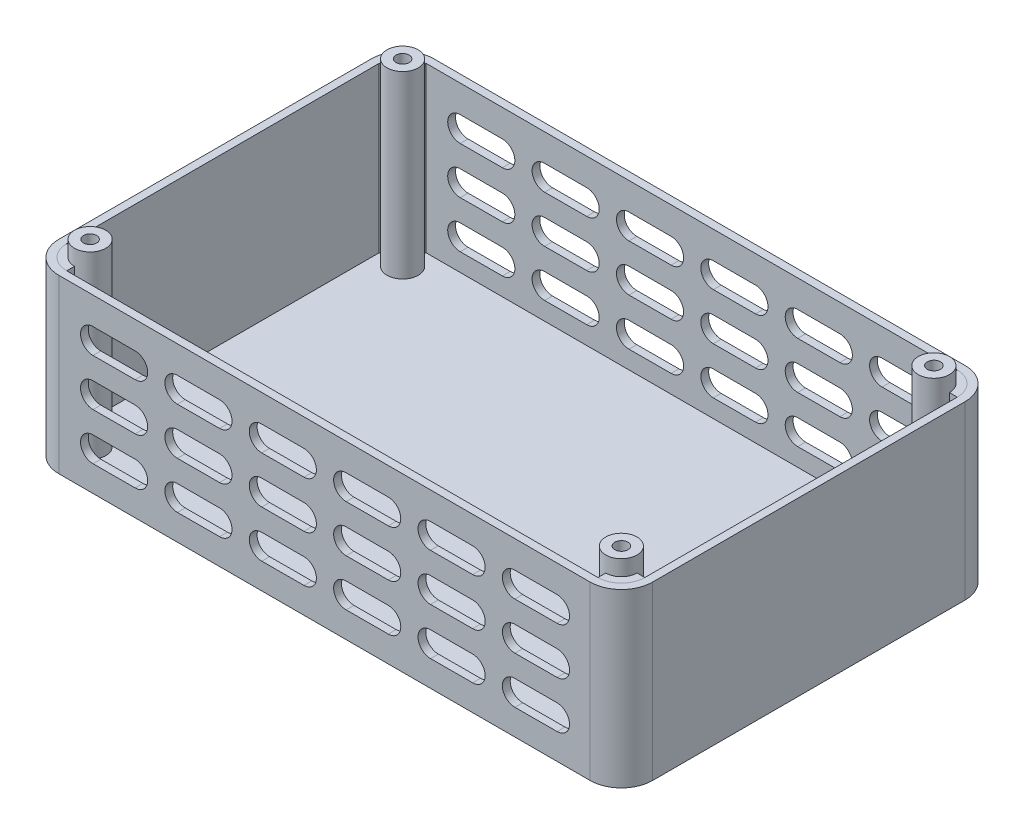
from build123d import *

# Parameters (mm, degrees)
SKETCH25_W                       = 190
SKETCH25_H                       = 120
BOSS_EXTRUDE5_DEPTH              = 55
FILLET2_R                        = 10
SHELL4_T                         = -2.5
SKETCH26_R                       = 5
BOSS_EXTRUDE8_DEPTH              = 57.5
BOSS_EXTRUDE9_DEPTH              = 52.5
BOSS_EXTRUDE9_2_DEPTH            = 52.5
BOSS_EXTRUDE9_3_DEPTH            = 52.5
BOSS_EXTRUDE9_4_DEPTH            = 52.5
CUT_EXTRUDE3_DEPTH               = 3
CUT_EXTRUDE4_START               = -3
CUT_EXTRUDE4_DEPTH               = 3
TAP_DRILL_FOR_M5_TAP1_AT_2_COUNT = 2
TAP_DRILL_FOR_M5_TAP1_AT_2_PITCH = 100
TAP_DRILL_FOR_M5_TAP1_AT_3_COUNT = 2
TAP_DRILL_FOR_M5_TAP1_AT_3_PITCH = 170
TAP_DRILL_FOR_M5_TAP1_AT_4_COUNT = 2
TAP_DRILL_FOR_M5_TAP1_AT_4_PITCH = 197.230829233


with BuildPart() as part:
    # Sketch25 → Boss-Extrude5 (new body)
    with BuildSketch(Plane(origin=(0, 0, 0), x_dir=(1, 0, 0), z_dir=(0, 1, 0))):
        with Locations((-0.175936119, -144.891398577)):
            Rectangle(SKETCH25_W, SKETCH25_H)
    extrude(amount=BOSS_EXTRUDE5_DEPTH)

    # Fillet2
    fillet2_edges = [part.edges().sort_by_distance(p)[0] for p in [
        (-95.175936119, 27.5, 84.891398577),
        (94.824063881, 27.5, 84.891398577),
        (94.824063881, 27.5, 204.891398577),
        (-95.175936119, 27.5, 204.891398577),
    ]]
    fillet(fillet2_edges, radius=FILLET2_R)

    # Shell4
    shell4_openings = [part.faces().sort_by_distance(p)[0] for p in [
        (-0.175936119, 55, 144.891398577),
    ]]
    offset(amount=SHELL4_T, openings=shell4_openings, kind=Kind.INTERSECTION)

    # Sketch26 → Boss-Extrude8 (add)
    with BuildSketch(Plane(origin=(0, 2.5, 0), x_dir=(1, 0, 0), z_dir=(0, 1, 0))):
        with Locations(Location((-85.175936119, -94.891398577, 0), (0, 0, 270))):
            Circle(SKETCH26_R)
        with Locations(Location((84.824063881, -94.891398577, 0), (0, 0, 270))):
            Circle(SKETCH26_R)
        with Locations(Location((-85.175936119, -194.891398577, 0), (0, 0, 270))):
            Circle(SKETCH26_R)
        with Locations(Location((84.824063881, -194.891398577, 0), (0, 0, 270))):
            Circle(SKETCH26_R)
    extrude(amount=BOSS_EXTRUDE8_DEPTH)

    # Sketch32 → Cut-Extrude3 (cut)
    with BuildSketch(Plane.XY.offset(204.891398577)):
        with BuildLine():
            Line((-74.249946348, 38.253764584), (-60.75, 38.291825034))
            ThreePointArc((-60.75, 38.291825034), (-56.769030225, 42.272794809), (-60.75, 46.253764584))
            Line((-60.75, 46.253764584), (-74.25, 46.253764584))
            ThreePointArc((-74.25, 46.253764584), (-78.25, 42.253737758), (-74.249946348, 38.253764584))
        make_face()
        with BuildLine():
            Line((-33.75, 46.253764584), (-47.25, 46.253764584))
            ThreePointArc((-47.25, 46.253764584), (-51.25, 42.253737758), (-47.249946348, 38.253764584))
            Line((-47.249946348, 38.253764584), (-33.75, 38.291825034))
            ThreePointArc((-33.75, 38.291825034), (-29.769030225, 42.272794809), (-33.75, 46.253764584))
        make_face()
        with BuildLine():
            Line((-6.75, 46.253764584), (-20.25, 46.253764584))
            ThreePointArc((-20.25, 46.253764584), (-24.25, 42.253737758), (-20.249946348, 38.253764584))
            Line((-20.249946348, 38.253764584), (-6.75, 38.291825034))
            ThreePointArc((-6.75, 38.291825034), (-2.769030225, 42.272794809), (-6.75, 46.253764584))
        make_face()
        with BuildLine():
            Line((20.25, 46.253764584), (6.75, 46.253764584))
            ThreePointArc((6.75, 46.253764584), (2.75, 42.253737758), (6.750053652, 38.253764584))
            Line((6.750053652, 38.253764584), (20.25, 38.291825034))
            ThreePointArc((20.25, 38.291825034), (24.230969775, 42.272794809), (20.25, 46.253764584))
        make_face()
        with BuildLine():
            Line((47.25, 46.253764584), (33.75, 46.253764584))
            ThreePointArc((33.75, 46.253764584), (29.75, 42.253737758), (33.750053652, 38.253764584))
            Line((33.750053652, 38.253764584), (47.25, 38.291825034))
            ThreePointArc((47.25, 38.291825034), (51.230969775, 42.272794809), (47.25, 46.253764584))
        make_face()
        with BuildLine():
            Line((74.25, 46.253764584), (60.75, 46.253764584))
            ThreePointArc((60.75, 46.253764584), (56.75, 42.253737758), (60.750053652, 38.253764584))
            Line((60.750053652, 38.253764584), (74.25, 38.291825034))
            ThreePointArc((74.25, 38.291825034), (78.230969775, 42.272794809), (74.25, 46.253764584))
        make_face()
        with BuildLine():
            Line((-33.75, 31.253764584), (-47.25, 31.253764584))
            ThreePointArc((-47.25, 31.253764584), (-51.25, 27.253737758), (-47.249946348, 23.253764584))
            Line((-47.249946348, 23.253764584), (-33.75, 23.291825034))
            ThreePointArc((-33.75, 23.291825034), (-29.769030225, 27.272794809), (-33.75, 31.253764584))
        make_face()
        with BuildLine():
            Line((-6.75, 31.253764584), (-20.25, 31.253764584))
            ThreePointArc((-20.25, 31.253764584), (-24.25, 27.253737758), (-20.249946348, 23.253764584))
            Line((-20.249946348, 23.253764584), (-6.75, 23.291825034))
            ThreePointArc((-6.75, 23.291825034), (-2.769030225, 27.272794809), (-6.75, 31.253764584))
        make_face()
        with BuildLine():
            Line((20.25, 31.253764584), (6.75, 31.253764584))
            ThreePointArc((6.75, 31.253764584), (2.75, 27.253737758), (6.750053652, 23.253764584))
            Line((6.750053652, 23.253764584), (20.25, 23.291825034))
            ThreePointArc((20.25, 23.291825034), (24.230969775, 27.272794809), (20.25, 31.253764584))
        make_face()
        with BuildLine():
            Line((47.25, 31.253764584), (33.75, 31.253764584))
            ThreePointArc((33.75, 31.253764584), (29.75, 27.253737758), (33.750053652, 23.253764584))
            Line((33.750053652, 23.253764584), (47.25, 23.291825034))
            ThreePointArc((47.25, 23.291825034), (51.230969775, 27.272794809), (47.25, 31.253764584))
        make_face()
        with BuildLine():
            Line((74.25, 31.253764584), (60.75, 31.253764584))
            ThreePointArc((60.75, 31.253764584), (56.75, 27.253737758), (60.750053652, 23.253764584))
            Line((60.750053652, 23.253764584), (74.25, 23.291825034))
            ThreePointArc((74.25, 23.291825034), (78.230969775, 27.272794809), (74.25, 31.253764584))
        make_face()
        with BuildLine():
            Line((-33.75, 16.253764584), (-47.25, 16.253764584))
            ThreePointArc((-47.25, 16.253764584), (-51.25, 12.253737758), (-47.249946348, 8.253764584))
            Line((-47.249946348, 8.253764584), (-33.75, 8.291825034))
            ThreePointArc((-33.75, 8.291825034), (-29.769030225, 12.272794809), (-33.75, 16.253764584))
        make_face()
        with BuildLine():
            Line((-6.75, 16.253764584), (-20.25, 16.253764584))
            ThreePointArc((-20.25, 16.253764584), (-24.25, 12.253737758), (-20.249946348, 8.253764584))
            Line((-20.249946348, 8.253764584), (-6.75, 8.291825034))
            ThreePointArc((-6.75, 8.291825034), (-2.769030225, 12.272794809), (-6.75, 16.253764584))
        make_face()
        with BuildLine():
            Line((20.25, 16.253764584), (6.75, 16.253764584))
            ThreePointArc((6.75, 16.253764584), (2.75, 12.253737758), (6.750053652, 8.253764584))
            Line((6.750053652, 8.253764584), (20.25, 8.291825034))
            ThreePointArc((20.25, 8.291825034), (24.230969775, 12.272794809), (20.25, 16.253764584))
        make_face()
        with BuildLine():
            Line((47.25, 16.253764584), (33.75, 16.253764584))
            ThreePointArc((33.75, 16.253764584), (29.75, 12.253737758), (33.750053652, 8.253764584))
            Line((33.750053652, 8.253764584), (47.25, 8.291825034))
            ThreePointArc((47.25, 8.291825034), (51.230969775, 12.272794809), (47.25, 16.253764584))
        make_face()
        with BuildLine():
            Line((74.25, 16.253764584), (60.75, 16.253764584))
            ThreePointArc((60.75, 16.253764584), (56.75, 12.253737758), (60.750053652, 8.253764584))
            Line((60.750053652, 8.253764584), (74.25, 8.291825034))
            ThreePointArc((74.25, 8.291825034), (78.230969775, 12.272794809), (74.25, 16.253764584))
        make_face()
        with BuildLine():
            Line((-60.75, 31.253764584), (-74.25, 31.253764584))
            ThreePointArc((-74.25, 31.253764584), (-78.25, 27.253737758), (-74.249946348, 23.253764584))
            Line((-74.249946348, 23.253764584), (-60.75, 23.291825034))
            ThreePointArc((-60.75, 23.291825034), (-56.769030225, 27.272794809), (-60.75, 31.253764584))
        make_face()
        with BuildLine():
            Line((-60.75, 16.253764584), (-74.25, 16.253764584))
            ThreePointArc((-74.25, 16.253764584), (-78.25, 12.253737758), (-74.249946348, 8.253764584))
            Line((-74.249946348, 8.253764584), (-60.75, 8.291825034))
            ThreePointArc((-60.75, 8.291825034), (-56.769030225, 12.272794809), (-60.75, 16.253764584))
        make_face()
    extrude(amount=-CUT_EXTRUDE3_DEPTH, mode=Mode.SUBTRACT)

    # Sketch34 → Cut-Extrude4 (cut)
    with BuildSketch(Plane(origin=(0, 0, 84.891398577), x_dir=(-1, 0, 0), z_dir=(0, 0, -1)).offset(CUT_EXTRUDE4_START)):
        with BuildLine():
            Line((-74.25, 38.291825034), (-60.750053652, 38.253764584))
            ThreePointArc((-60.750053652, 38.253764584), (-56.75, 42.253737758), (-60.75, 46.253764584))
            Line((-60.75, 46.253764584), (-74.25, 46.253764584))
            ThreePointArc((-74.25, 46.253764584), (-78.230969775, 42.272794809), (-74.25, 38.291825034))
        make_face()
        with BuildLine():
            Line((-33.75, 46.253764584), (-47.25, 46.253764584))
            ThreePointArc((-47.25, 46.253764584), (-51.230969775, 42.272794809), (-47.25, 38.291825034))
            Line((-47.25, 38.291825034), (-33.750053652, 38.253764584))
            ThreePointArc((-33.750053652, 38.253764584), (-29.75, 42.253737758), (-33.75, 46.253764584))
        make_face()
        with BuildLine():
            Line((-6.75, 46.253764584), (-20.25, 46.253764584))
            ThreePointArc((-20.25, 46.253764584), (-24.230969775, 42.272794809), (-20.25, 38.291825034))
            Line((-20.25, 38.291825034), (-6.750053652, 38.253764584))
            ThreePointArc((-6.750053652, 38.253764584), (-2.75, 42.253737758), (-6.75, 46.253764584))
        make_face()
        with BuildLine():
            Line((20.25, 46.253764584), (6.75, 46.253764584))
            ThreePointArc((6.75, 46.253764584), (2.769030225, 42.272794809), (6.75, 38.291825034))
            Line((6.75, 38.291825034), (20.249946348, 38.253764584))
            ThreePointArc((20.249946348, 38.253764584), (24.25, 42.253737758), (20.25, 46.253764584))
        make_face()
        with BuildLine():
            Line((47.25, 46.253764584), (33.75, 46.253764584))
            ThreePointArc((33.75, 46.253764584), (29.769030225, 42.272794809), (33.75, 38.291825034))
            Line((33.75, 38.291825034), (47.249946348, 38.253764584))
            ThreePointArc((47.249946348, 38.253764584), (51.249999999, 42.253737758), (47.25, 46.253764584))
        make_face()
        with BuildLine():
            Line((74.249999999, 46.253764584), (60.749999999, 46.253764584))
            ThreePointArc((60.749999999, 46.253764584), (56.769030224, 42.272794809), (60.749999999, 38.291825034))
            Line((60.749999999, 38.291825034), (74.249946347, 38.253764584))
            ThreePointArc((74.249946347, 38.253764584), (78.249999999, 42.253737758), (74.249999999, 46.253764584))
        make_face()
        with BuildLine():
            Line((-33.75, 31.253764584), (-47.25, 31.253764584))
            ThreePointArc((-47.25, 31.253764584), (-51.230969775, 27.272794809), (-47.25, 23.291825034))
            Line((-47.25, 23.291825034), (-33.750053652, 23.253764584))
            ThreePointArc((-33.750053652, 23.253764584), (-29.75, 27.253737758), (-33.75, 31.253764584))
        make_face()
        with BuildLine():
            Line((-6.75, 31.253764584), (-20.25, 31.253764584))
            ThreePointArc((-20.25, 31.253764584), (-24.230969775, 27.272794809), (-20.25, 23.291825034))
            Line((-20.25, 23.291825034), (-6.750053652, 23.253764584))
            ThreePointArc((-6.750053652, 23.253764584), (-2.75, 27.253737758), (-6.75, 31.253764584))
        make_face()
        with BuildLine():
            Line((20.25, 31.253764584), (6.75, 31.253764584))
            ThreePointArc((6.75, 31.253764584), (2.769030225, 27.272794809), (6.75, 23.291825034))
            Line((6.75, 23.291825034), (20.249946348, 23.253764584))
            ThreePointArc((20.249946348, 23.253764584), (24.25, 27.253737758), (20.25, 31.253764584))
        make_face()
        with BuildLine():
            Line((47.25, 31.253764584), (33.75, 31.253764584))
            ThreePointArc((33.75, 31.253764584), (29.769030225, 27.272794809), (33.75, 23.291825034))
            Line((33.75, 23.291825034), (47.249946348, 23.253764584))
            ThreePointArc((47.249946348, 23.253764584), (51.249999999, 27.253737758), (47.25, 31.253764584))
        make_face()
        with BuildLine():
            Line((74.249999999, 31.253764584), (60.749999999, 31.253764584))
            ThreePointArc((60.749999999, 31.253764584), (56.769030224, 27.272794809), (60.749999999, 23.291825034))
            Line((60.749999999, 23.291825034), (74.249946347, 23.253764584))
            ThreePointArc((74.249946347, 23.253764584), (78.249999999, 27.253737758), (74.249999999, 31.253764584))
        make_face()
        with BuildLine():
            Line((-33.75, 16.253764584), (-47.25, 16.253764584))
            ThreePointArc((-47.25, 16.253764584), (-51.230969775, 12.272794809), (-47.25, 8.291825034))
            Line((-47.25, 8.291825034), (-33.750053652, 8.253764584))
            ThreePointArc((-33.750053652, 8.253764584), (-29.75, 12.253737758), (-33.75, 16.253764584))
        make_face()
        with BuildLine():
            Line((-6.75, 16.253764584), (-20.25, 16.253764584))
            ThreePointArc((-20.25, 16.253764584), (-24.230969775, 12.272794809), (-20.25, 8.291825034))
            Line((-20.25, 8.291825034), (-6.750053652, 8.253764584))
            ThreePointArc((-6.750053652, 8.253764584), (-2.75, 12.253737758), (-6.75, 16.253764584))
        make_face()
        with BuildLine():
            Line((20.25, 16.253764584), (6.75, 16.253764584))
            ThreePointArc((6.75, 16.253764584), (2.769030225, 12.272794809), (6.75, 8.291825034))
            Line((6.75, 8.291825034), (20.249946348, 8.253764584))
            ThreePointArc((20.249946348, 8.253764584), (24.25, 12.253737758), (20.25, 16.253764584))
        make_face()
        with BuildLine():
            Line((47.25, 16.253764584), (33.75, 16.253764584))
            ThreePointArc((33.75, 16.253764584), (29.769030225, 12.272794809), (33.75, 8.291825034))
            Line((33.75, 8.291825034), (47.249946348, 8.253764584))
            ThreePointArc((47.249946348, 8.253764584), (51.249999999, 12.253737758), (47.25, 16.253764584))
        make_face()
        with BuildLine():
            Line((74.249999999, 16.253764584), (60.749999999, 16.253764584))
            ThreePointArc((60.749999999, 16.253764584), (56.769030224, 12.272794809), (60.749999999, 8.291825034))
            Line((60.749999999, 8.291825034), (74.249946347, 8.253764584))
            ThreePointArc((74.249946347, 8.253764584), (78.249999999, 12.253737758), (74.249999999, 16.253764584))
        make_face()
        with BuildLine():
            Line((-60.75, 31.253764584), (-74.25, 31.253764584))
            ThreePointArc((-74.25, 31.253764584), (-78.230969775, 27.272794809), (-74.25, 23.291825034))
            Line((-74.25, 23.291825034), (-60.750053652, 23.253764584))
            ThreePointArc((-60.750053652, 23.253764584), (-56.75, 27.253737758), (-60.75, 31.253764584))
        make_face()
        with BuildLine():
            Line((-60.75, 16.253764584), (-74.25, 16.253764584))
            ThreePointArc((-74.25, 16.253764584), (-78.230969775, 12.272794809), (-74.25, 8.291825034))
            Line((-74.25, 8.291825034), (-60.750053652, 8.253764584))
            ThreePointArc((-60.750053652, 8.253764584), (-56.75, 12.253737758), (-60.75, 16.253764584))
        make_face()
    extrude(amount=CUT_EXTRUDE4_DEPTH, mode=Mode.SUBTRACT)


with BuildPart() as body_2:
    # Sketch29 → Boss-Extrude9 (new body)
    with BuildSketch(Plane(origin=(0, 2.5, 0), x_dir=(1, 0, 0), z_dir=(0, 1, 0))):
        with BuildLine():
            Line((-85.175936119, -87.391398577), (-85.175936119, -94.891398577))
            Line((-85.175936119, -94.891398577), (-92.675936119, -94.891398577))
            ThreePointArc((-92.675936119, -94.891398577), (-90.479236978, -89.588097719), (-85.175936119, -87.391398577))
        make_face()
    extrude(amount=BOSS_EXTRUDE9_DEPTH)


with BuildPart() as body_3:
    # Sketch29 → Boss-Extrude9 2 (new body)
    with BuildSketch(Plane(origin=(0, 2.5, 0), x_dir=(1, 0, 0), z_dir=(0, 1, 0))):
        with BuildLine():
            Line((84.824063881, -87.391398577), (84.824063881, -94.891398577))
            Line((84.824063881, -94.891398577), (92.324063881, -94.891398577))
            ThreePointArc((92.324063881, -94.891398577), (90.12736474, -89.588097719), (84.824063881, -87.391398577))
        make_face()
    extrude(amount=BOSS_EXTRUDE9_2_DEPTH)


with BuildPart() as body_4:
    # Sketch29 → Boss-Extrude9 3 (new body)
    with BuildSketch(Plane(origin=(0, 2.5, 0), x_dir=(1, 0, 0), z_dir=(0, 1, 0))):
        with BuildLine():
            Line((92.324063881, -194.891398577), (84.824063881, -194.891398577))
            Line((84.824063881, -194.891398577), (84.824063881, -202.391398577))
            ThreePointArc((84.824063881, -202.391398577), (90.12736474, -200.194699436), (92.324063881, -194.891398577))
        make_face()
    extrude(amount=BOSS_EXTRUDE9_3_DEPTH)


with BuildPart() as body_5:
    # Sketch29 → Boss-Extrude9 4 (new body)
    with BuildSketch(Plane(origin=(0, 2.5, 0), x_dir=(1, 0, 0), z_dir=(0, 1, 0))):
        with BuildLine():
            Line((-85.175936119, -202.391398577), (-85.175936119, -194.891398577))
            Line((-85.175936119, -194.891398577), (-92.675936119, -194.891398577))
            ThreePointArc((-92.675936119, -194.891398577), (-90.479236978, -200.194699436), (-85.175936119, -202.391398577))
        make_face()
    extrude(amount=BOSS_EXTRUDE9_4_DEPTH)


with BuildPart() as tap_drill_for_m5_tap1_tool:
    # Sketch36 → Tap Drill for M5 Tap1 (revolve)
    with BuildSketch(Plane(origin=(-85.175936119, 60, 94.891398577), x_dir=(0, 0, 1), z_dir=(1, 0, 0))):
        Polygon((0, 0), (0, 21.2618073), (2.1, 20), (2.1, 0), align=None)
    tap_drill_for_m5_tap1 = revolve(axis=Axis((-85.175936119, 66.35, 94.891398577), (0, -1, 0)))


with BuildPart() as part_1:
    add(part.part)

    # Tap Drill for M5 Tap1: cut by tap_drill_for_m5_tap1_tool
    add(tap_drill_for_m5_tap1_tool.part, mode=Mode.SUBTRACT)


with BuildPart() as body_2_1:
    add(body_2.part)

    # Tap Drill for M5 Tap1: cut by tap_drill_for_m5_tap1_tool
    add(tap_drill_for_m5_tap1_tool.part, mode=Mode.SUBTRACT)


with BuildPart() as tap_drill_for_m5_tap1_at_2_tool:
    # Tap Drill for M5 Tap1 at 2: Tap Drill for M5 Tap1 ×2
    with Locations(*[(0, 0, i * TAP_DRILL_FOR_M5_TAP1_AT_2_PITCH) for i in range(1, TAP_DRILL_FOR_M5_TAP1_AT_2_COUNT)]):
        add(tap_drill_for_m5_tap1)


with BuildPart() as part_2:
    add(part_1.part)

    # Tap Drill for M5 Tap1 at 2: cut by tap_drill_for_m5_tap1_at_2_tool
    add(tap_drill_for_m5_tap1_at_2_tool.part, mode=Mode.SUBTRACT)


with BuildPart() as body_5_1:
    add(body_5.part)

    # Tap Drill for M5 Tap1 at 2: cut by tap_drill_for_m5_tap1_at_2_tool
    add(tap_drill_for_m5_tap1_at_2_tool.part, mode=Mode.SUBTRACT)


with BuildPart() as tap_drill_for_m5_tap1_at_3_tool:
    # Tap Drill for M5 Tap1 at 3: Tap Drill for M5 Tap1 ×2
    with Locations(*[(i * TAP_DRILL_FOR_M5_TAP1_AT_3_PITCH, 0, 0) for i in range(1, TAP_DRILL_FOR_M5_TAP1_AT_3_COUNT)]):
        add(tap_drill_for_m5_tap1)


with BuildPart() as part_3:
    add(part_2.part)

    # Tap Drill for M5 Tap1 at 3: cut by tap_drill_for_m5_tap1_at_3_tool
    add(tap_drill_for_m5_tap1_at_3_tool.part, mode=Mode.SUBTRACT)


with BuildPart() as body_3_1:
    add(body_3.part)

    # Tap Drill for M5 Tap1 at 3: cut by tap_drill_for_m5_tap1_at_3_tool
    add(tap_drill_for_m5_tap1_at_3_tool.part, mode=Mode.SUBTRACT)


with BuildPart() as tap_drill_for_m5_tap1_at_4_tool:
    # Tap Drill for M5 Tap1 at 4: Tap Drill for M5 Tap1 ×2
    with Locations(*[Vector(0.8619342151577696, 0, 0.5070201265633937) * (i * TAP_DRILL_FOR_M5_TAP1_AT_4_PITCH) for i in range(1, TAP_DRILL_FOR_M5_TAP1_AT_4_COUNT)]):
        add(tap_drill_for_m5_tap1)


with BuildPart() as part_4:
    add(part_3.part)

    # Tap Drill for M5 Tap1 at 4: cut by tap_drill_for_m5_tap1_at_4_tool
    add(tap_drill_for_m5_tap1_at_4_tool.part, mode=Mode.SUBTRACT)


with BuildPart() as body_4_1:
    add(body_4.part)

    # Tap Drill for M5 Tap1 at 4: cut by tap_drill_for_m5_tap1_at_4_tool
    add(tap_drill_for_m5_tap1_at_4_tool.part, mode=Mode.SUBTRACT)


solid = Compound([body_2_1.part, body_5_1.part, body_3_1.part, part_4.part, body_4_1.part])
